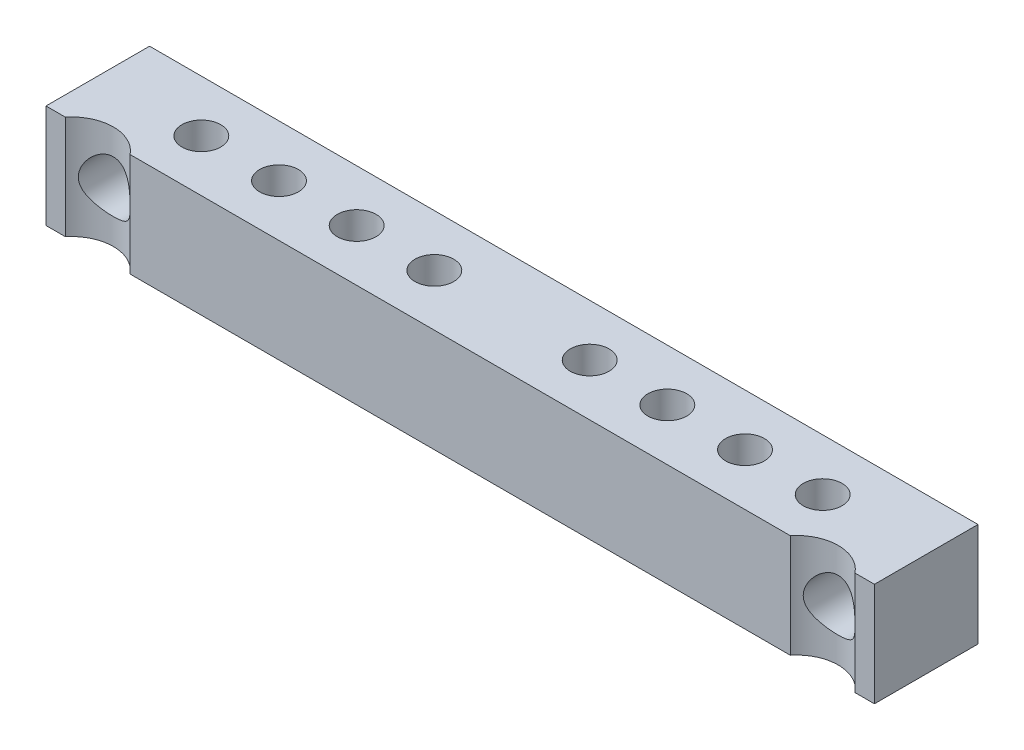
from build123d import *

# Parameters (mm, degrees)
CROQUIS1_W              = 32
CROQUIS1_H              = 4
CROQUIS1_R              = 1
SALIENTE_EXTRUIR1_DEPTH = 4
CROQUIS2_R              = 1.6
CROQUIS2_R_2            = 0.75
CORTAR_EXTRUIR1_DEPTH   = 4


with BuildPart() as part:
    # Croquis1 → Saliente-Extruir1 (new body)
    with BuildSketch(Plane.XY):
        with Locations((16, 2)):
            Rectangle(CROQUIS1_W, CROQUIS1_H)
        with Locations((2, 2)):
            Circle(CROQUIS1_R, mode=Mode.SUBTRACT)
        with Locations(Location((30, 2, 0), (0, 0, 180))):
            Circle(CROQUIS1_R, mode=Mode.SUBTRACT)
    extrude(amount=SALIENTE_EXTRUIR1_DEPTH)

    # Croquis2 → Cortar-Extruir1 (cut)
    with BuildSketch(Plane.XZ):
        with Locations((2, 5)):
            Circle(CROQUIS2_R)
        with Locations(Location((13, 2, 0), (0, 0, 270))):
            Circle(CROQUIS2_R_2)
        with Locations(Location((10, 2, 0), (0, 0, 270))):
            Circle(CROQUIS2_R_2)
        with Locations(Location((7, 2, 0), (0, 0, 270))):
            Circle(CROQUIS2_R_2)
        with Locations(Location((25, 2, 0), (0, 0, 90))):
            Circle(CROQUIS2_R_2)
        with Locations(Location((22, 2, 0), (0, 0, 90))):
            Circle(CROQUIS2_R_2)
        with Locations(Location((19, 2, 0), (0, 0, 90))):
            Circle(CROQUIS2_R_2)
        with Locations((30, 5)):
            Circle(CROQUIS2_R)
        with Locations(Location((28, 2, 0), (0, 0, 90))):
            Circle(CROQUIS2_R_2)
        with Locations(Location((4, 2, 0), (0, 0, 270))):
            Circle(CROQUIS2_R_2)
    extrude(amount=-CORTAR_EXTRUIR1_DEPTH, mode=Mode.SUBTRACT)


solid = part.part
